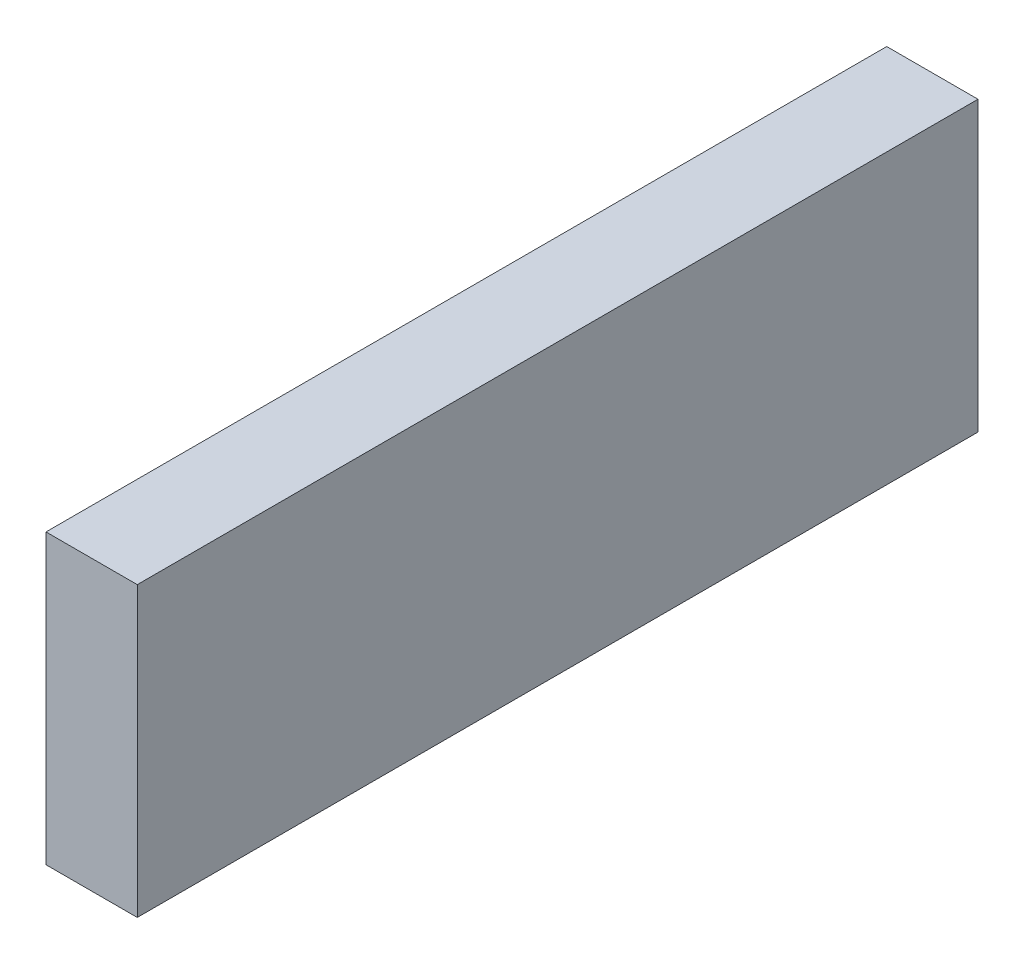
from build123d import *

# Parameters (mm, degrees)
SKETCH1_W           = 175
SKETCH1_H           = 60
BOSS_EXTRUDE1_DEPTH = 19


with BuildPart() as part:
    # Sketch1 → Boss-Extrude1 (new body)
    with BuildSketch(Plane(origin=(0, 0, 0), x_dir=(0, 0, -1), z_dir=(1, 0, 0))):
        Rectangle(SKETCH1_W, SKETCH1_H)
    extrude(amount=BOSS_EXTRUDE1_DEPTH)


solid = part.part
